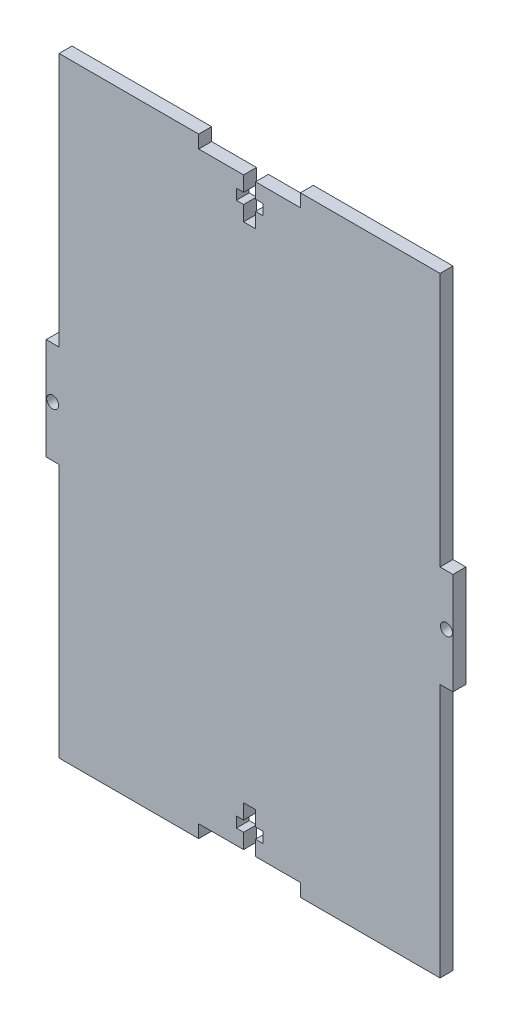
from build123d import *

# Parameters (mm, degrees)
SKETCH1_R           = 1.47
BOSS_EXTRUDE1_DEPTH = 1.5875


with BuildPart() as part:
    # Sketch1 → Boss-Extrude1 (new, symmetric)
    with BuildSketch(Plane.XY):
        Polygon((-12.5, 75), (-46.825, 75), (-46.825, 12.5), (-50, 12.5), (-50, -12.5), (-46.825, -12.5), (-46.825, -75), (-12.5, -75), (-12.5, -71.825), (-1.47, -71.825), (-1.47, -68.125), (-3.25, -68.125), (-3.25, -65.525), (-1.47, -65.525), (-1.47, -61.825), (1.47, -61.825), (1.47, -65.525), (3.25, -65.525), (3.25, -68.125), (1.47, -68.125), (1.47, -71.825), (12.5, -71.825), (12.5, -75), (46.825, -75), (46.825, -12.5), (50, -12.5), (50, 12.5), (46.825, 12.5), (46.825, 75), (12.5, 75), (12.5, 71.825), (1.47, 71.825), (1.47, 68.125), (3.25, 68.125), (3.25, 65.525), (1.47, 65.525), (1.47, 61.825), (-1.47, 61.825), (-1.47, 65.525), (-3.25, 65.525), (-3.25, 68.125), (-1.47, 68.125), (-1.47, 71.825), (-12.5, 71.825), align=None)
        with Locations((-48.4125, 0)):
            Circle(SKETCH1_R, mode=Mode.SUBTRACT)
        with Locations(Location((48.4125, 0, 0), (0, 0, 180))):
            Circle(SKETCH1_R, mode=Mode.SUBTRACT)
    extrude(amount=BOSS_EXTRUDE1_DEPTH, both=True)


solid = part.part
